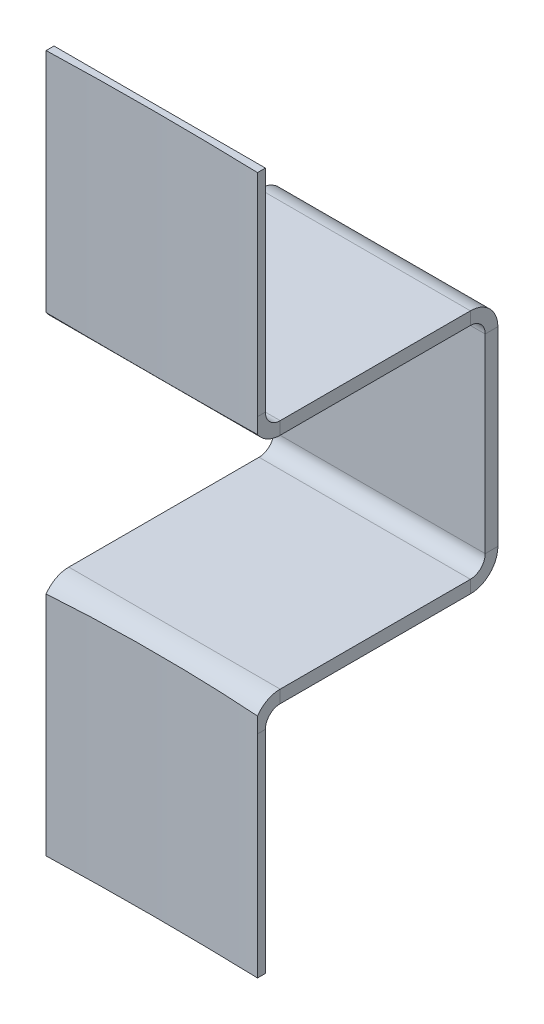
from build123d import *

# Parameters (mm, degrees)
SKETCH3_W          = 10
SKETCH3_H          = 0.6
SKETCH5_R          = 169.6
CUT_EXTRUDE1_DEPTH = 36.23762194


with BuildPart() as part:
    # Sweep1: sweep along a path in Sketch2
    with BuildLine(Plane(origin=(0, 0, 0), x_dir=(0, 0, -1), z_dir=(1, 0, 0))) as sweep1_path:
        Line((0, 0), (0, -10))
        ThreePointArc((0, -10), (0.292893219, -10.707106781), (1, -11))
        Line((1, -11), (10, -11))
        ThreePointArc((10, -11), (10.707106781, -11.292893219), (11, -12))
        Line((11, -12), (11, -21))
        ThreePointArc((11, -21), (10.707106781, -21.707106781), (10, -22))
        Line((10, -22), (1, -22))
        ThreePointArc((1, -22), (0.292893219, -22.292893219), (0, -23))
        Line((0, -23), (0, -33))
    # Sketch3 → Sweep1 (sweep)
    with BuildSketch(Plane(origin=(0, 0, 0), x_dir=(1, 0, 0), z_dir=(0, 1, 0))):
        Rectangle(SKETCH3_W, SKETCH3_H)
    sweep(path=sweep1_path.line)

    # Sketch5 → Cut-Extrude1 (cut, through all)
    with BuildSketch(Plane(origin=(0, 0, 0), x_dir=(1, 0, 0), z_dir=(0, 1, 0))):
        with Locations((0, -169.599)):
            Circle(SKETCH5_R)
    extrude(amount=-CUT_EXTRUDE1_DEPTH, mode=Mode.SUBTRACT)


solid = part.part
